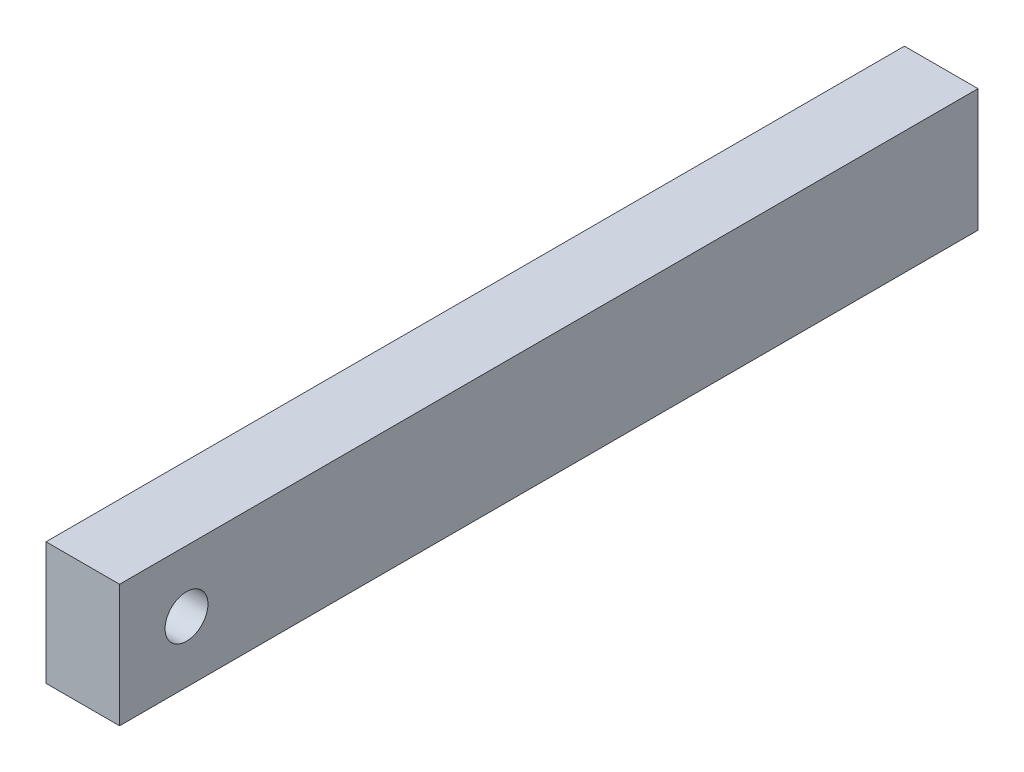
from build123d import *

# Parameters (mm, degrees)
ESBO_O1_W                = 6
ESBO_O1_H                = 10
RESSALTO_EXTRUS_O1_DEPTH = 70
ESBO_O2_R                = 1.75
CORTE_EXTRUS_O1_DEPTH    = 71.434366612


with BuildPart() as part:
    # Esboço1 → Ressalto-extrusão1 (new body)
    with BuildSketch(Plane.XY):
        Rectangle(ESBO_O1_W, ESBO_O1_H)
    extrude(amount=RESSALTO_EXTRUS_O1_DEPTH)

    # Esboço2 → Corte-extrusão1 (cut, through all)
    with BuildSketch(Plane(origin=(3, 0, 0), x_dir=(0, 0, -1), z_dir=(1, 0, 0))):
        with Locations((-64.542442941, 0)):
            Circle(ESBO_O2_R)
    extrude(amount=-CORTE_EXTRUS_O1_DEPTH, mode=Mode.SUBTRACT)


solid = part.part
